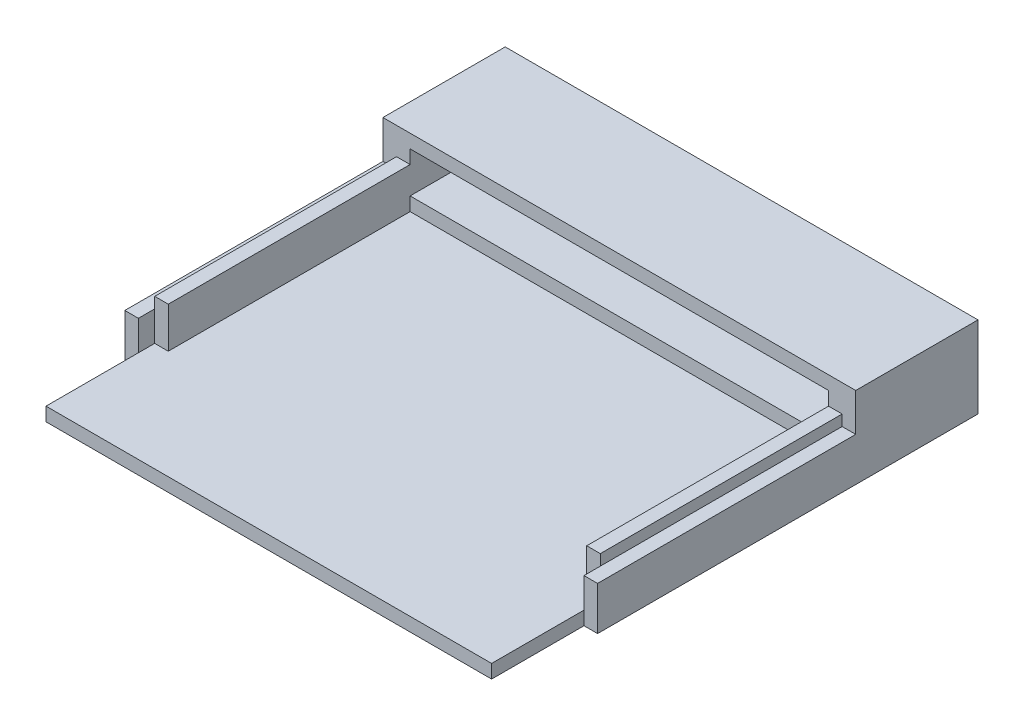
from build123d import *

# Parameters (mm, degrees)
SKETCH1_W           = 164
SKETCH1_H           = 94
BOSS_EXTRUDE1_DEPTH = 5
BOSS_EXTRUDE2_DEPTH = 5
SKETCH2_W           = 164
SKETCH2_H           = 30
BOSS_EXTRUDE3_DEPTH = 5
SKETCH3_W           = 5
SKETCH3_H           = 94
BOSS_EXTRUDE4_DEPTH = 10
SKETCH4_W           = 5
SKETCH4_H           = 100
BOSS_EXTRUDE5_DEPTH = 16
SKETCH5_W           = 5
SKETCH5_H           = 5
CUT_EXTRUDE1_DEPTH  = 4
BOSS_EXTRUDE6_DEPTH = 40
BOSS_EXTRUDE7_DEPTH = 45
SKETCH9_W           = 164
SKETCH9_H           = 5
BOSS_EXTRUDE8_DEPTH = 10


with BuildPart() as part:
    # Sketch1 → Boss-Extrude1 (new body)
    with BuildSketch(Plane(origin=(0, 0, 0), x_dir=(1, 0, 0), z_dir=(0, 1, 0))):
        with Locations((77, 42)):
            Rectangle(SKETCH1_W, SKETCH1_H)
    extrude(amount=-BOSS_EXTRUDE1_DEPTH)

    # Sketch1<3> → Boss-Extrude2 (add)
    with BuildSketch(Plane(origin=(0, 0, 0), x_dir=(1, 0, 0), z_dir=(0, 1, 0))):
        Polygon((0, -5), (0, 0), (0, 84), (154, 84), (154, 0), (154, -5), (159, -5), (159, 89), (-5, 89), (-5, -5), align=None)
    extrude(amount=BOSS_EXTRUDE2_DEPTH)

    # Sketch2 → Boss-Extrude3 (add)
    with BuildSketch(Plane(origin=(0, -5, 0), x_dir=(-1, 0, 0), z_dir=(0, -1, 0))):
        with Locations((-77, -20)):
            Rectangle(SKETCH2_W, SKETCH2_H)
    extrude(amount=-BOSS_EXTRUDE3_DEPTH)

    # Sketch3 → Boss-Extrude4 (add)
    with BuildSketch(Plane(origin=(0, 5, 0), x_dir=(1, 0, 0), z_dir=(0, 1, 0))):
        with Locations((-2.5, 42)):
            Rectangle(SKETCH3_W, SKETCH3_H)
        with Locations((156.5, 42)):
            Rectangle(SKETCH3_W, SKETCH3_H)
    extrude(amount=BOSS_EXTRUDE4_DEPTH)

    # Sketch4 → Boss-Extrude5 (add)
    with BuildSketch(Plane.XZ.offset(5)):
        with Locations((-7.5, -39)):
            Rectangle(SKETCH4_W, SKETCH4_H)
        with Locations((161.5, -39)):
            Rectangle(SKETCH4_W, SKETCH4_H)
    extrude(amount=-BOSS_EXTRUDE5_DEPTH)

    # Sketch5 → Cut-Extrude1 (cut)
    with BuildSketch(Plane(origin=(0, 15, 0), x_dir=(1, 0, 0), z_dir=(0, 1, 0))):
        with Locations((-2.5, 86.5)):
            Rectangle(SKETCH5_W, SKETCH5_H)
        with Locations((156.5, 86.5)):
            Rectangle(SKETCH5_W, SKETCH5_H)
    extrude(amount=-CUT_EXTRUDE1_DEPTH, mode=Mode.SUBTRACT)

    # Sketch6 → Boss-Extrude6 (add)
    with BuildSketch(Plane(origin=(0, 0, -89), x_dir=(-1, 0, 0), z_dir=(0, 0, -1))):
        Polygon((10, -5), (10, 11), (0, 11), (0, 5), (-154, 5), (-154, 11), (-164, 11), (-164, -5), align=None)
    extrude(amount=BOSS_EXTRUDE6_DEPTH)

    # Sketch8 → Boss-Extrude7 (add)
    with BuildSketch(Plane(origin=(0, 0, -129), x_dir=(-1, 0, 0), z_dir=(0, 0, -1))):
        Polygon((-164, 11), (-154, 11), (-154, 20), (0, 20), (0, 11), (10, 11), (10, 25), (-164, 25), align=None)
    extrude(amount=-BOSS_EXTRUDE7_DEPTH)

    # Sketch9 → Boss-Extrude8 (add)
    with BuildSketch(Plane.XY.offset(35)):
        with Locations((77, -2.5)):
            Rectangle(SKETCH9_W, SKETCH9_H)
    extrude(amount=BOSS_EXTRUDE8_DEPTH)


solid = part.part
